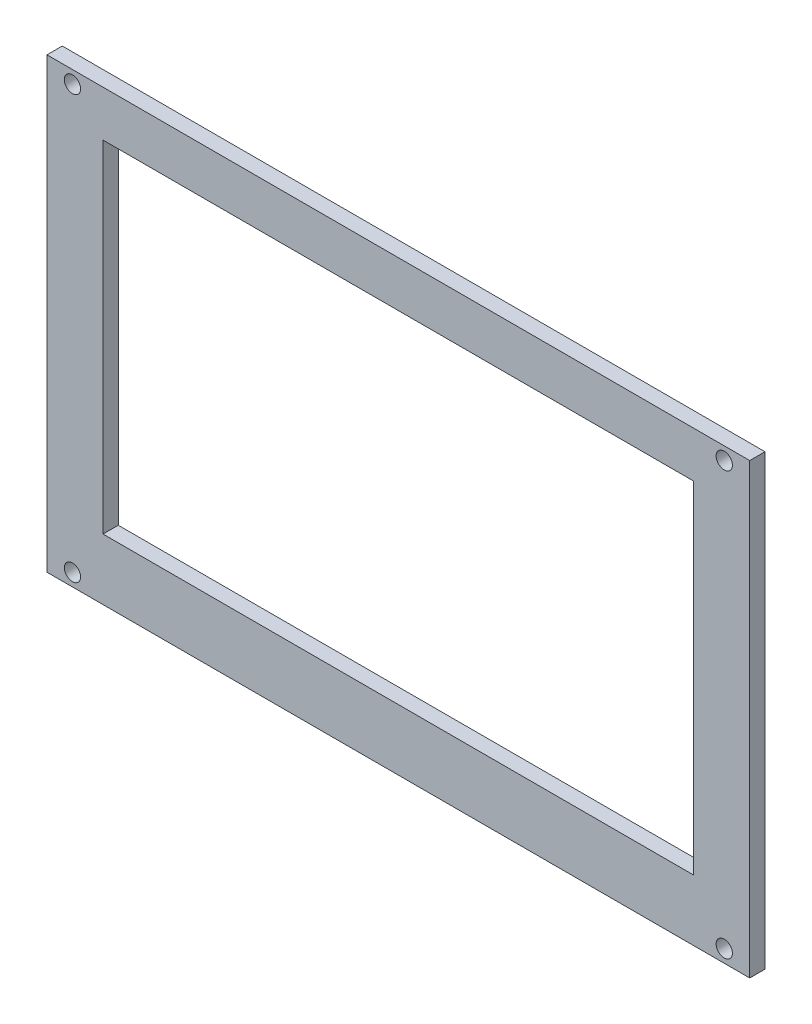
from build123d import *

# Parameters (mm, degrees)
CROQUIS1_W                   = 138
CROQUIS1_H                   = 88
SALIENTE_EXTRUIR1_DEPTH      = 3
CORTAR_EXTRUIR1_REACH        = 165.698
CROQUIS2_W                   = 116
CROQUIS2_H                   = 67
TALADRO_DE_MARGEN_PARA_M31_D = 3.2


with BuildPart() as part:
    # Croquis1 → Saliente-Extruir1 (new body)
    with BuildSketch(Plane.XY):
        with Locations((69, 44)):
            Rectangle(CROQUIS1_W, CROQUIS1_H)
    extrude(amount=SALIENTE_EXTRUIR1_DEPTH)

    # Croquis2 → Cortar-Extruir1 (cut, up to next)
    with BuildSketch(Plane.XY.offset(3), mode=Mode.PRIVATE) as cortar_extruir1_sk1:
        with Locations((69, 45.5)):
            Rectangle(CROQUIS2_W, CROQUIS2_H)
    cortar_extruir1_tool1 = extrude(cortar_extruir1_sk1.sketch, amount=-CORTAR_EXTRUIR1_REACH, mode=Mode.PRIVATE) & part.part
    add(cortar_extruir1_tool1.solids().sort_by_distance((69, 45.5, 3))[0], mode=Mode.SUBTRACT)

    # Taladro de margen para M31 (through all)
    with Locations(Plane(origin=(5, 85.5, 3), x_dir=(1, 0, 0), z_dir=(0, 0, 1))):
        with Locations((0, 0), (128, 0), (128, -83), (0, -83)):
            Hole(TALADRO_DE_MARGEN_PARA_M31_D / 2)


solid = part.part
